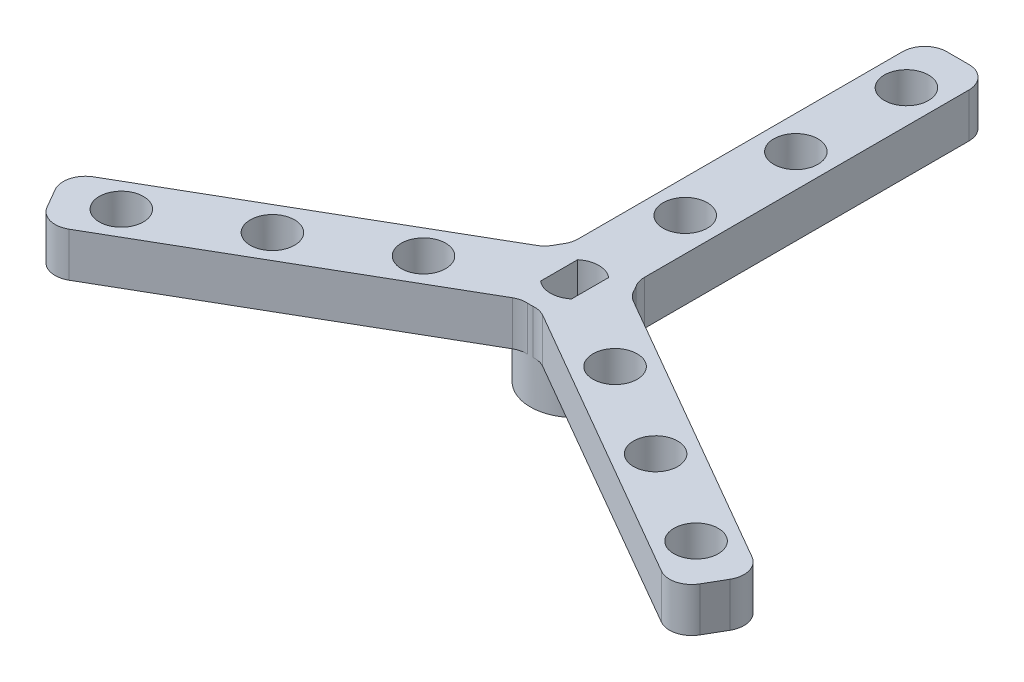
from build123d import *

# Parameters (mm, degrees)
SKETCH1_R           = 5
BOSS_EXTRUDE1_DEPTH = 10
SKETCH2_W           = 7.5
SKETCH2_H           = 40
BOSS_EXTRUDE4_DEPTH = 5
SKETCH4_R           = 2.5
CUT_EXTRUDE1_DEPTH  = 100
FILLET1_R           = 2.5
FILLET2_R           = 2.5


with BuildPart() as part:
    # Sketch1 → Boss-Extrude1 (new body)
    with BuildSketch(Plane(origin=(0, 0, 0), x_dir=(1, 0, 0), z_dir=(0, 1, 0))):
        with Locations(Location((0.037460471, 3.715413796, 0), (0, 0, 270))):
            Circle(SKETCH1_R)
        with BuildLine():
            ThreePointArc((-1.712539529, 1.62008566), (0.037460471, 0.985413796), (1.787460471, 1.62008566))
            Line((1.787460471, 1.62008566), (1.787460471, 5.811378349))
            ThreePointArc((1.787460471, 5.811378349), (0.037460471, 6.446050212), (-1.712539529, 5.811378349))
            Line((-1.712539529, 5.811378349), (-1.712539529, 1.62008566))
        make_face(mode=Mode.SUBTRACT)
    extrude(amount=BOSS_EXTRUDE1_DEPTH)

    # Sketch2 → Boss-Extrude4 (add)
    with BuildSketch(Plane(origin=(0, 10, 0), x_dir=(1, 0, 0), z_dir=(0, 1, 0))):
        Polygon((4.77657028, 5.309414491), (1.02657028, -1.185776038), (35.667586431, -21.185776038), (39.417586431, -14.690585509), align=None)
        with Locations((0.037460471, 27.022602935)):
            Rectangle(SKETCH2_W, SKETCH2_H)
        Polygon((-4.701649339, 5.309414491), (-0.951649339, -1.185776038), (-35.59266549, -21.185776038), (-39.34266549, -14.690585509), align=None)
    extrude(amount=-BOSS_EXTRUDE4_DEPTH)

    # Sketch4 → Cut-Extrude1 (cut)
    with BuildSketch(Plane(origin=(0, 10, 0), x_dir=(1, 0, 0), z_dir=(0, 1, 0))):
        with Locations(Location((0.037460471, 16.216050212, 0), (0, 0, 270))):
            Circle(SKETCH4_R)
        with Locations(Location((0.037460471, 28.716050212, 0), (0, 0, 270))):
            Circle(SKETCH4_R)
        with Locations(Location((0.037460471, 41.216050212, 0), (0, 0, 270))):
            Circle(SKETCH4_R)
        with Locations(Location((-10.788016154, -2.533674249, 0), (0, 0, 270))):
            Circle(SKETCH4_R)
        with Locations(Location((-21.613492779, -8.78339871, 0), (0, 0, 270))):
            Circle(SKETCH4_R)
        with Locations(Location((-32.438969404, -15.033123172, 0), (0, 0, 270))):
            Circle(SKETCH4_R)
        with Locations(Location((10.862937095, -2.533674249, 0), (0, 0, 90))):
            Circle(SKETCH4_R)
        with Locations(Location((21.68841372, -8.78339871, 0), (0, 0, 90))):
            Circle(SKETCH4_R)
        with Locations(Location((32.513890345, -15.033123172, 0), (0, 0, 90))):
            Circle(SKETCH4_R)
    extrude(amount=-CUT_EXTRUDE1_DEPTH, mode=Mode.SUBTRACT)

    # Fillet1
    fillet1_edges = [part.edges().sort_by_distance(p)[0] for p in [
        (4.77657028, 7.5, -5.309414491),
        (1.02657028, 7.5, 1.185776038),
        (-3.712539529, 7.5, -7.022602935),
        (3.787460471, 7.5, -7.022602935),
        (-4.701649339, 7.5, -5.309414491),
        (-0.951649339, 7.5, 1.185776038),
    ]]
    fillet(fillet1_edges, radius=FILLET1_R)

    # Fillet2
    fillet2_edges = [part.edges().sort_by_distance(p)[0] for p in [
        (39.417586431, 7.5, 14.690585509),
        (35.667586431, 7.5, 21.185776038),
        (-3.712539529, 7.5, -47.022602935),
        (3.787460471, 7.5, -47.022602935),
        (-39.34266549, 7.5, 14.690585509),
        (-35.59266549, 7.5, 21.185776038),
    ]]
    fillet(fillet2_edges, radius=FILLET2_R)


solid = part.part
